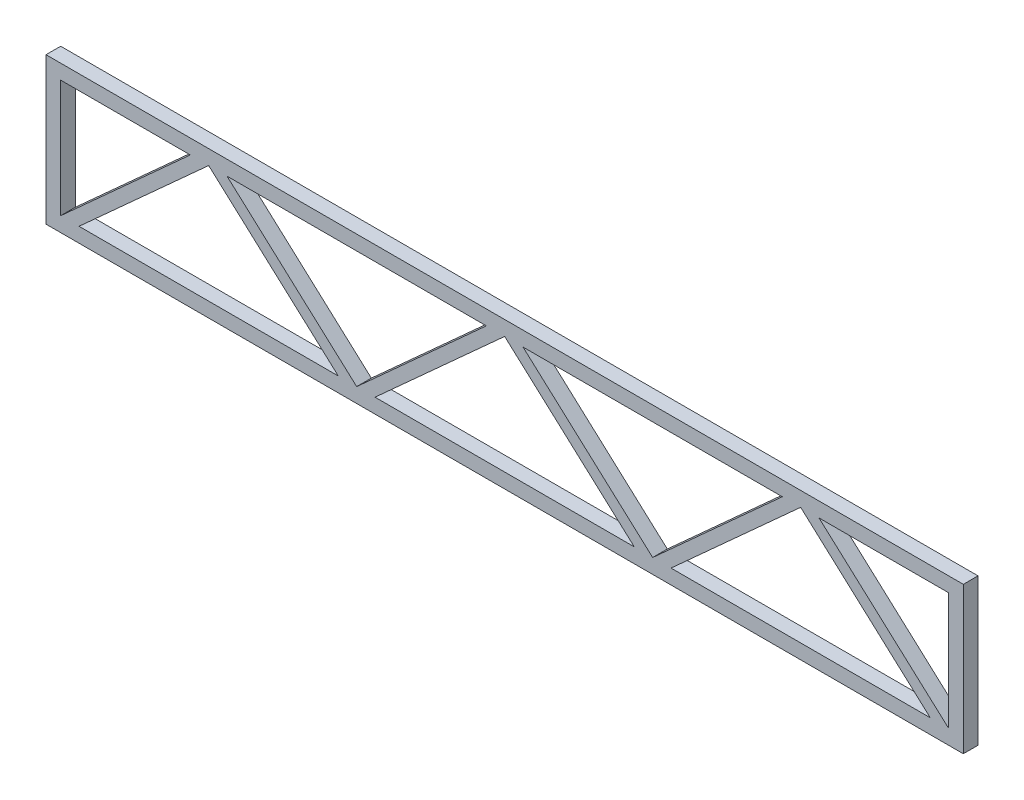
from build123d import *

# Parameters (mm, degrees)
SKETCH_1_W      = 250
SKETCH_1_H      = 40
SKETCH_1_W_2    = 242
SKETCH_1_H_2    = 32
EXTRUDE_1_DEPTH = 4


with BuildPart() as part:
    # 草图1 → 凸台-拉伸1 (new body)
    # profile 1 of 7: a face of its own
    with BuildSketch(Plane.XY):
        Rectangle(SKETCH_1_W, SKETCH_1_H)
        Rectangle(SKETCH_1_W_2, SKETCH_1_H_2, mode=Mode.SUBTRACT)
    # profile 2 of 7: a face of its own
    with BuildSketch(Plane.XY):
        Polygon((-80.666666667, 16), (-85.666666667, 16), (-121, -16), (-116, -16), align=None)
    # profile 3 of 7: a face of its own
    with BuildSketch(Plane.XY):
        Polygon((-75.666666667, 16), (-80.666666667, 16), (-45.333333333, -16), (-40.333333333, -16), align=None)
    # profile 4 of 7: a face of its own
    with BuildSketch(Plane.XY):
        Polygon((0, 16), (-5, 16), (-40.333333333, -16), (-35.333333333, -16), align=None)
    # profile 5 of 7: a face of its own
    with BuildSketch(Plane.XY):
        Polygon((5, 16), (0, 16), (35.333333333, -16), (40.333333333, -16), align=None)
    # profile 6 of 7: a face of its own
    with BuildSketch(Plane.XY):
        Polygon((80.666666667, 16), (75.666666667, 16), (40.333333333, -16), (45.333333333, -16), align=None)
    # profile 7 of 7: a face of its own
    with BuildSketch(Plane.XY):
        Polygon((85.666666667, 16), (80.666666667, 16), (116, -16), (121, -16), align=None)
    extrude(amount=EXTRUDE_1_DEPTH)


solid = part.part
